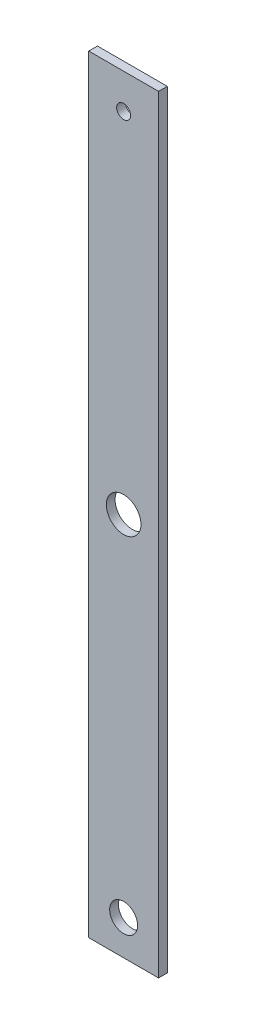
from build123d import *

# Parameters (mm, degrees)
SKETCH1_W           = 12.7
SKETCH1_H           = 139.7
SKETCH1_R           = 3.1496
SKETCH1_R_2         = 1.27
SKETCH1_R_3         = 2.54
BOSS_EXTRUDE1_DEPTH = 1.5875


with BuildPart() as part:
    # Sketch1 → Boss-Extrude1 (new body)
    with BuildSketch(Plane.XY):
        Rectangle(SKETCH1_W, SKETCH1_H)
        Circle(SKETCH1_R, mode=Mode.SUBTRACT)
        with Locations((0, 63.5)):
            Circle(SKETCH1_R_2, mode=Mode.SUBTRACT)
        with Locations(Location((0, -63.5, 0), (0, 0, 180))):
            Circle(SKETCH1_R_3, mode=Mode.SUBTRACT)
    extrude(amount=BOSS_EXTRUDE1_DEPTH)


solid = part.part
